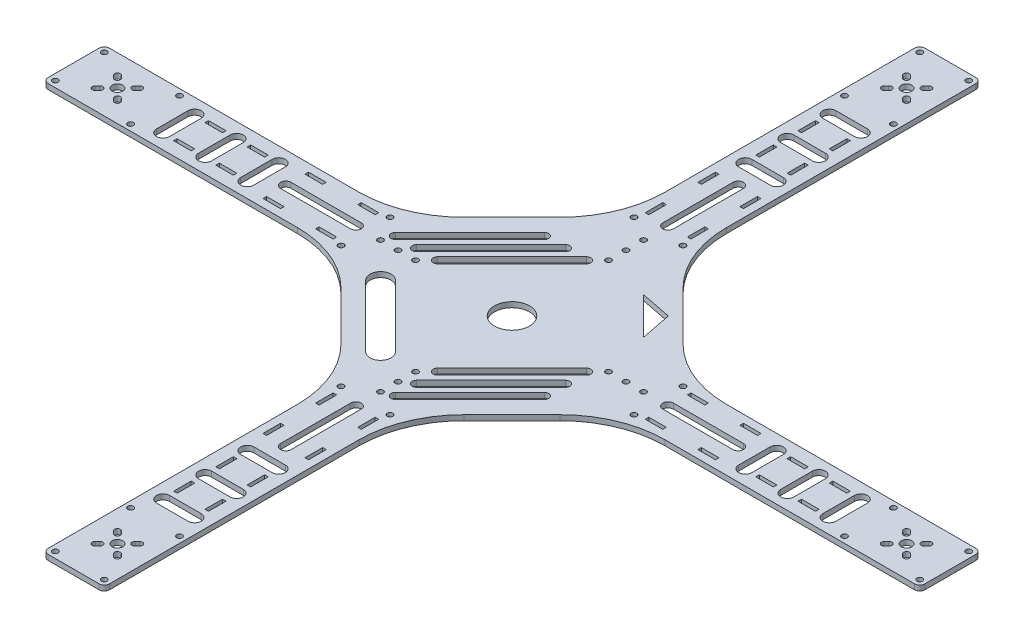
from build123d import *

# Parameters (mm, degrees)
SKETCH_221_R        = 1.6
SKETCH_221_R_2      = 3
SKETCH_221_W        = 2
SKETCH_221_H        = 10
SKETCH_221_W_2      = 10
SKETCH_221_H_2      = 2
EXTRUDE_1_DEPTH     = 3
SKETCH_1_R          = 1.6
SKETCH_1_R_2        = 10
CUT_EXTRUDE_1_DEPTH = 537.78114721
FILLET_1_R          = 3


with BuildPart() as part:
    # Sketch 221 → 凸台-拉伸1 (new body)
    with BuildSketch(Plane(origin=(0, 0, 0), x_dir=(1, 0, 0), z_dir=(0, 1, 0))):
        with BuildLine():
            Line((17.5, 25), (-17.5, 25))
            Line((-17.5, 25), (-17.5, -25))
            Line((-17.5, -25), (-17.5, -120.147186258))
            ThreePointArc((-17.5, -120.147186258), (-22.067228049, -143.1081922), (-35.073593129, -162.573593129))
            Line((-35.073593129, -162.573593129), (-62.426406871, -189.926406871))
            ThreePointArc((-62.426406871, -189.926406871), (-81.8918078, -202.932771951), (-104.852813742, -207.5))
            Line((-104.852813742, -207.5), (-200, -207.5))
            Line((-200, -207.5), (-250, -207.5))
            Line((-250, -207.5), (-250, -242.5))
            Line((-250, -242.5), (-200, -242.5))
            Line((-200, -242.5), (-104.852813742, -242.5))
            ThreePointArc((-104.852813742, -242.5), (-81.8918078, -247.067228049), (-62.426406871, -260.073593129))
            Line((-62.426406871, -260.073593129), (-35.073593129, -287.426406871))
            ThreePointArc((-35.073593129, -287.426406871), (-22.067228049, -306.8918078), (-17.5, -329.852813742))
            Line((-17.5, -329.852813742), (-17.5, -425))
            Line((-17.5, -425), (-17.5, -475))
            Line((-17.5, -475), (17.5, -475))
            Line((17.5, -475), (17.5, -425))
            Line((17.5, -425), (17.5, -329.852813742))
            ThreePointArc((17.5, -329.852813742), (22.067228049, -306.8918078), (35.073593129, -287.426406871))
            Line((35.073593129, -287.426406871), (62.426406871, -260.073593129))
            ThreePointArc((62.426406871, -260.073593129), (81.8918078, -247.067228049), (104.852813742, -242.5))
            Line((104.852813742, -242.5), (200, -242.5))
            Line((200, -242.5), (250, -242.5))
            Line((250, -242.5), (250, -207.5))
            Line((250, -207.5), (200, -207.5))
            Line((200, -207.5), (104.852813742, -207.5))
            ThreePointArc((104.852813742, -207.5), (81.8918078, -202.932771951), (62.426406871, -189.926406871))
            Line((62.426406871, -189.926406871), (35.073593129, -162.573593129))
            ThreePointArc((35.073593129, -162.573593129), (22.067228049, -143.1081922), (17.5, -120.147186258))
            Line((17.5, -120.147186258), (17.5, -25))
            Line((17.5, -25), (17.5, 25))
        make_face()
        with Locations(Location((-13.964466094, -471.464466094, 0), (0, 0, 270))):
            Circle(SKETCH_221_R, mode=Mode.SUBTRACT)
        with BuildLine():
            ThreePointArc((-6.081118318, -453.818376618), (-3.818376618, -453.818376618), (-3.818376618, -456.081118318))
            Line((-3.818376618, -456.081118318), (-5.232590181, -457.495331881))
            ThreePointArc((-5.232590181, -457.495331881), (-7.495331881, -457.495331881), (-7.495331881, -455.232590181))
            Line((-7.495331881, -455.232590181), (-6.081118318, -453.818376618))
        make_face(mode=Mode.SUBTRACT)
        with Locations(Location((0, -450, 0), (0, 0, 270))):
            Circle(SKETCH_221_R_2, mode=Mode.SUBTRACT)
        with BuildLine():
            ThreePointArc((-3.818376618, -443.918881682), (-3.818376618, -446.181623382), (-6.081118318, -446.181623382))
            Line((-6.081118318, -446.181623382), (-7.495331881, -444.767409819))
            ThreePointArc((-7.495331881, -444.767409819), (-7.495331881, -442.504668119), (-5.232590181, -442.504668119))
            Line((-5.232590181, -442.504668119), (-3.818376618, -443.918881682))
        make_face(mode=Mode.SUBTRACT)
        with Locations(Location((-13.964466094, -428.535533906, 0), (0, 0, 270))):
            Circle(SKETCH_221_R, mode=Mode.SUBTRACT)
        with BuildLine():
            ThreePointArc((-9, -418.75), (-12.75, -415), (-9, -411.25))
            Line((-9, -411.25), (9, -411.25))
            ThreePointArc((9, -411.25), (12.75, -415), (9, -418.75))
            Line((9, -418.75), (0, -418.75))
            Line((0, -418.75), (-9, -418.75))
        make_face(mode=Mode.SUBTRACT)
        Polygon((-7.93903755, -408), (-9, -408), (-9.93903755, -408), (-9.93903755, -398), (-9, -398), (-7.93903755, -398), align=None, mode=Mode.SUBTRACT)
        with Locations((-8.93903755, -378.95882731)):
            Rectangle(SKETCH_221_W, SKETCH_221_H, mode=Mode.SUBTRACT)
        with BuildLine():
            ThreePointArc((-244.864466094, -238.964466094), (-245.852172602, -240.442673346), (-247.595836944, -240.095836944))
            ThreePointArc((-247.595836944, -240.095836944), (-247.076759586, -237.486258842), (-244.864466094, -238.964466094))
        make_face(mode=Mode.SUBTRACT)
        with BuildLine():
            ThreePointArc((-231.081118318, -228.818376618), (-228.818376618, -228.818376618), (-228.818376618, -231.081118318))
            Line((-228.818376618, -231.081118318), (-230.232590181, -232.495331881))
            ThreePointArc((-230.232590181, -232.495331881), (-232.495331881, -232.495331881), (-232.495331881, -230.232590181))
            Line((-232.495331881, -230.232590181), (-231.081118318, -228.818376618))
        make_face(mode=Mode.SUBTRACT)
        with BuildLine():
            ThreePointArc((-221.181623382, -231.081118318), (-221.181623382, -228.818376618), (-218.918881682, -228.818376618))
            Line((-218.918881682, -228.818376618), (-217.504668119, -230.232590181))
            ThreePointArc((-217.504668119, -230.232590181), (-217.504668119, -232.495331881), (-219.767409819, -232.495331881))
            Line((-219.767409819, -232.495331881), (-221.181623382, -231.081118318))
        make_face(mode=Mode.SUBTRACT)
        with Locations(Location((-203.535533906, -238.964466094, 0), (0, 0, 270))):
            Circle(SKETCH_221_R, mode=Mode.SUBTRACT)
        with Locations((-178, -233.93903755)):
            Rectangle(SKETCH_221_W_2, SKETCH_221_H_2, mode=Mode.SUBTRACT)
        with Locations((-153.95882731, -233.93903755)):
            Rectangle(SKETCH_221_W_2, SKETCH_221_H_2, mode=Mode.SUBTRACT)
        with Locations((-12, -349)):
            Rectangle(SKETCH_221_W, SKETCH_221_H, mode=Mode.SUBTRACT)
        with Locations((-12, -319)):
            Rectangle(SKETCH_221_W, SKETCH_221_H, mode=Mode.SUBTRACT)
        with Locations(Location((-13.964466094, -308.535533906, 0), (0, 0, 270))):
            Circle(SKETCH_221_R, mode=Mode.SUBTRACT)
        with Locations((-124, -237)):
            Rectangle(SKETCH_221_W_2, SKETCH_221_H_2, mode=Mode.SUBTRACT)
        with Locations((-94, -237)):
            Rectangle(SKETCH_221_W_2, SKETCH_221_H_2, mode=Mode.SUBTRACT)
        with BuildLine():
            ThreePointArc((-89, -222), (-86, -225), (-89, -228))
            Line((-89, -228), (-129, -228))
            ThreePointArc((-129, -228), (-132, -225), (-129, -222))
            Line((-129, -222), (-89, -222))
        make_face(mode=Mode.SUBTRACT)
        with Locations(Location((-83.535533906, -238.964466094, 0), (0, 0, 270))):
            Circle(SKETCH_221_R, mode=Mode.SUBTRACT)
        with BuildLine():
            ThreePointArc((15.564466094, -471.464466094), (15.442673346, -472.076759586), (15.095836944, -472.595836944))
            ThreePointArc((15.095836944, -472.595836944), (12.486258842, -470.852172602), (15.564466094, -471.464466094))
        make_face(mode=Mode.SUBTRACT)
        with BuildLine():
            ThreePointArc((3.818376618, -456.081118318), (3.818376618, -453.818376618), (6.081118318, -453.818376618))
            Line((6.081118318, -453.818376618), (7.495331881, -455.232590181))
            ThreePointArc((7.495331881, -455.232590181), (7.495331881, -457.495331881), (5.232590181, -457.495331881))
            Line((5.232590181, -457.495331881), (3.818376618, -456.081118318))
        make_face(mode=Mode.SUBTRACT)
        with BuildLine():
            ThreePointArc((6.081118318, -446.181623382), (3.818376618, -446.181623382), (3.818376618, -443.918881682))
            Line((3.818376618, -443.918881682), (5.232590181, -442.504668119))
            ThreePointArc((5.232590181, -442.504668119), (7.495331881, -442.504668119), (7.495331881, -444.767409819))
            Line((7.495331881, -444.767409819), (6.081118318, -446.181623382))
        make_face(mode=Mode.SUBTRACT)
        with Locations(Location((13.964466094, -428.535533906, 0), (0, 0, 270))):
            Circle(SKETCH_221_R, mode=Mode.SUBTRACT)
        with Locations((8.93903755, -403)):
            Rectangle(SKETCH_221_W, SKETCH_221_H, mode=Mode.SUBTRACT)
        with BuildLine():
            Line((9, -394.75), (-9, -394.75))
            ThreePointArc((-9, -394.75), (-12.75, -391), (-9, -387.25))
            Line((-9, -387.25), (9, -387.25))
            ThreePointArc((9, -387.25), (12.75, -391), (9, -394.75))
        make_face(mode=Mode.SUBTRACT)
        with Locations((8.93903755, -378.95882731)):
            Rectangle(SKETCH_221_W, SKETCH_221_H, mode=Mode.SUBTRACT)
        with BuildLine():
            ThreePointArc((9, -363.25), (12.75, -367), (9, -370.75))
            Line((9, -370.75), (-9, -370.75))
            ThreePointArc((-9, -370.75), (-12.75, -367), (-9, -363.25))
            Line((-9, -363.25), (9, -363.25))
        make_face(mode=Mode.SUBTRACT)
        with Locations((12, -349)):
            Rectangle(SKETCH_221_W, SKETCH_221_H, mode=Mode.SUBTRACT)
        with BuildLine():
            ThreePointArc((-3, -314), (0, -311), (3, -314))
            Line((3, -314), (3, -354))
            ThreePointArc((3, -354), (0, -357), (-3, -354))
            Line((-3, -354), (-3, -314))
        make_face(mode=Mode.SUBTRACT)
        with Locations((12, -319)):
            Rectangle(SKETCH_221_W, SKETCH_221_H, mode=Mode.SUBTRACT)
        with Locations(Location((13.964466094, -308.535533906, 0), (0, 0, 270))):
            Circle(SKETCH_221_R, mode=Mode.SUBTRACT)
        with Locations(Location((83.535533906, -238.964466094, 0), (0, 0, 270))):
            Circle(SKETCH_221_R, mode=Mode.SUBTRACT)
        with Locations((94, -237)):
            Rectangle(SKETCH_221_W_2, SKETCH_221_H_2, mode=Mode.SUBTRACT)
        with Locations((124, -237)):
            Rectangle(SKETCH_221_W_2, SKETCH_221_H_2, mode=Mode.SUBTRACT)
        with Locations((153.95882731, -233.93903755)):
            Rectangle(SKETCH_221_W_2, SKETCH_221_H_2, mode=Mode.SUBTRACT)
        Polygon((183, -232.93903755), (183, -234), (183, -234.93903755), (173, -234.93903755), (173, -234), (173, -232.93903755), align=None, mode=Mode.SUBTRACT)
        with Locations(Location((203.535533906, -238.964466094, 0), (0, 0, 270))):
            Circle(SKETCH_221_R, mode=Mode.SUBTRACT)
        with BuildLine():
            ThreePointArc((218.918881682, -228.818376618), (221.181623382, -228.818376618), (221.181623382, -231.081118318))
            Line((221.181623382, -231.081118318), (219.767409819, -232.495331881))
            ThreePointArc((219.767409819, -232.495331881), (217.504668119, -232.495331881), (217.504668119, -230.232590181))
            Line((217.504668119, -230.232590181), (218.918881682, -228.818376618))
        make_face(mode=Mode.SUBTRACT)
        with BuildLine():
            ThreePointArc((228.818376618, -231.081118318), (228.818376618, -228.818376618), (231.081118318, -228.818376618))
            Line((231.081118318, -228.818376618), (232.495331881, -230.232590181))
            ThreePointArc((232.495331881, -230.232590181), (232.495331881, -232.495331881), (230.232590181, -232.495331881))
            Line((230.232590181, -232.495331881), (228.818376618, -231.081118318))
        make_face(mode=Mode.SUBTRACT)
        with Locations(Location((246.464466094, -238.964466094, 0), (0, 0, 270))):
            Circle(SKETCH_221_R, mode=Mode.SUBTRACT)
        with Locations(Location((-246.464466094, -211.035533906, 0), (0, 0, 270))):
            Circle(SKETCH_221_R, mode=Mode.SUBTRACT)
        with BuildLine():
            ThreePointArc((-228.818376618, -218.918881682), (-228.818376618, -221.181623382), (-231.081118318, -221.181623382))
            Line((-231.081118318, -221.181623382), (-232.495331881, -219.767409819))
            ThreePointArc((-232.495331881, -219.767409819), (-232.495331881, -217.504668119), (-230.232590181, -217.504668119))
            Line((-230.232590181, -217.504668119), (-228.818376618, -218.918881682))
        make_face(mode=Mode.SUBTRACT)
        with Locations(Location((-225, -225, 0), (0, 0, 270))):
            Circle(SKETCH_221_R_2, mode=Mode.SUBTRACT)
        with BuildLine():
            ThreePointArc((-218.918881682, -221.181623382), (-221.181623382, -221.181623382), (-221.181623382, -218.918881682))
            Line((-221.181623382, -218.918881682), (-219.767409819, -217.504668119))
            ThreePointArc((-219.767409819, -217.504668119), (-217.504668119, -217.504668119), (-217.504668119, -219.767409819))
            Line((-217.504668119, -219.767409819), (-218.918881682, -221.181623382))
        make_face(mode=Mode.SUBTRACT)
        with Locations(Location((-203.535533906, -211.035533906, 0), (0, 0, 270))):
            Circle(SKETCH_221_R, mode=Mode.SUBTRACT)
        with BuildLine():
            ThreePointArc((-193.75, -216), (-190, -212.25), (-186.25, -216))
            Line((-186.25, -216), (-186.25, -234))
            ThreePointArc((-186.25, -234), (-190, -237.75), (-193.75, -234))
            Line((-193.75, -234), (-193.75, -225))
            Line((-193.75, -225), (-193.75, -216))
        make_face(mode=Mode.SUBTRACT)
        Polygon((-183, -217.06096245), (-183, -216), (-183, -215.06096245), (-173, -215.06096245), (-173, -216), (-173, -217.06096245), align=None, mode=Mode.SUBTRACT)
        with BuildLine():
            Line((-169.75, -234), (-169.75, -216))
            ThreePointArc((-169.75, -216), (-166, -212.25), (-162.25, -216))
            Line((-162.25, -216), (-162.25, -234))
            ThreePointArc((-162.25, -234), (-166, -237.75), (-169.75, -234))
        make_face(mode=Mode.SUBTRACT)
        with BuildLine():
            ThreePointArc((-138.25, -234), (-142, -237.75), (-145.75, -234))
            Line((-145.75, -234), (-145.75, -216))
            ThreePointArc((-145.75, -216), (-142, -212.25), (-138.25, -216))
            Line((-138.25, -216), (-138.25, -234))
        make_face(mode=Mode.SUBTRACT)
        with Locations((-153.95882731, -216.06096245)):
            Rectangle(SKETCH_221_W_2, SKETCH_221_H_2, mode=Mode.SUBTRACT)
        with Locations((-124, -213)):
            Rectangle(SKETCH_221_W_2, SKETCH_221_H_2, mode=Mode.SUBTRACT)
        with Locations((-94, -213)):
            Rectangle(SKETCH_221_W_2, SKETCH_221_H_2, mode=Mode.SUBTRACT)
        with Locations(Location((-83.535533906, -211.035533906, 0), (0, 0, 270))):
            Circle(SKETCH_221_R, mode=Mode.SUBTRACT)
        with Locations(Location((-13.964466094, -141.464466094, 0), (0, 0, 270))):
            Circle(SKETCH_221_R, mode=Mode.SUBTRACT)
        with Locations((-12, -131)):
            Rectangle(SKETCH_221_W, SKETCH_221_H, mode=Mode.SUBTRACT)
        with BuildLine():
            ThreePointArc((3, -136), (0, -139), (-3, -136))
            Line((-3, -136), (-3, -96))
            ThreePointArc((-3, -96), (0, -93), (3, -96))
            Line((3, -96), (3, -136))
        make_face(mode=Mode.SUBTRACT)
        with Locations((-12, -101)):
            Rectangle(SKETCH_221_W, SKETCH_221_H, mode=Mode.SUBTRACT)
        with BuildLine():
            ThreePointArc((-9, -86.75), (-12.75, -83), (-9, -79.25))
            Line((-9, -79.25), (9, -79.25))
            ThreePointArc((9, -79.25), (12.75, -83), (9, -86.75))
            Line((9, -86.75), (-9, -86.75))
        make_face(mode=Mode.SUBTRACT)
        with Locations((-8.93903755, -71.04117269)):
            Rectangle(SKETCH_221_W, SKETCH_221_H, mode=Mode.SUBTRACT)
        with BuildLine():
            Line((-9, -55.25), (9, -55.25))
            ThreePointArc((9, -55.25), (12.75, -59), (9, -62.75))
            Line((9, -62.75), (-9, -62.75))
            ThreePointArc((-9, -62.75), (-12.75, -59), (-9, -55.25))
        make_face(mode=Mode.SUBTRACT)
        with Locations((-8.93903755, -47)):
            Rectangle(SKETCH_221_W, SKETCH_221_H, mode=Mode.SUBTRACT)
        with BuildLine():
            ThreePointArc((-9, -38.75), (-12.75, -35), (-9, -31.25))
            Line((-9, -31.25), (0, -31.25))
            Line((0, -31.25), (9, -31.25))
            ThreePointArc((9, -31.25), (12.75, -35), (9, -38.75))
            Line((9, -38.75), (-9, -38.75))
        make_face(mode=Mode.SUBTRACT)
        with Locations(Location((-13.964466094, -21.464466094, 0), (0, 0, 270))):
            Circle(SKETCH_221_R, mode=Mode.SUBTRACT)
        with BuildLine():
            ThreePointArc((-6.081118318, -3.818376618), (-3.818376618, -3.818376618), (-3.818376618, -6.081118318))
            Line((-3.818376618, -6.081118318), (-5.232590181, -7.495331881))
            ThreePointArc((-5.232590181, -7.495331881), (-7.495331881, -7.495331881), (-7.495331881, -5.232590181))
            Line((-7.495331881, -5.232590181), (-6.081118318, -3.818376618))
        make_face(mode=Mode.SUBTRACT)
        with Locations(Location((0, 0, 0), (0, 0, 270))):
            Circle(SKETCH_221_R_2, mode=Mode.SUBTRACT)
        with BuildLine():
            ThreePointArc((-3.818376618, 6.081118318), (-3.818376618, 3.818376618), (-6.081118318, 3.818376618))
            Line((-6.081118318, 3.818376618), (-7.495331881, 5.232590181))
            ThreePointArc((-7.495331881, 5.232590181), (-7.495331881, 7.495331881), (-5.232590181, 7.495331881))
            Line((-5.232590181, 7.495331881), (-3.818376618, 6.081118318))
        make_face(mode=Mode.SUBTRACT)
        with BuildLine():
            ThreePointArc((-12.364466094, 21.464466094), (-14.576759586, 19.986258842), (-15.095836944, 22.595836944))
            ThreePointArc((-15.095836944, 22.595836944), (-13.352172602, 22.942673346), (-12.364466094, 21.464466094))
        make_face(mode=Mode.SUBTRACT)
        with Locations(Location((83.535533906, -211.035533906, 0), (0, 0, 270))):
            Circle(SKETCH_221_R, mode=Mode.SUBTRACT)
        with BuildLine():
            ThreePointArc((89, -228), (86, -225), (89, -222))
            Line((89, -222), (129, -222))
            ThreePointArc((129, -222), (132, -225), (129, -228))
            Line((129, -228), (89, -228))
        make_face(mode=Mode.SUBTRACT)
        with Locations((94, -213)):
            Rectangle(SKETCH_221_W_2, SKETCH_221_H_2, mode=Mode.SUBTRACT)
        with Locations((124, -213)):
            Rectangle(SKETCH_221_W_2, SKETCH_221_H_2, mode=Mode.SUBTRACT)
        with Locations(Location((13.964466094, -141.464466094, 0), (0, 0, 270))):
            Circle(SKETCH_221_R, mode=Mode.SUBTRACT)
        with Locations((12, -131)):
            Rectangle(SKETCH_221_W, SKETCH_221_H, mode=Mode.SUBTRACT)
        with Locations((12, -101)):
            Rectangle(SKETCH_221_W, SKETCH_221_H, mode=Mode.SUBTRACT)
        with BuildLine():
            ThreePointArc((138.25, -216), (142, -212.25), (145.75, -216))
            Line((145.75, -216), (145.75, -234))
            ThreePointArc((145.75, -234), (142, -237.75), (138.25, -234))
            Line((138.25, -234), (138.25, -216))
        make_face(mode=Mode.SUBTRACT)
        with Locations((153.95882731, -216.06096245)):
            Rectangle(SKETCH_221_W_2, SKETCH_221_H_2, mode=Mode.SUBTRACT)
        with BuildLine():
            Line((169.75, -216), (169.75, -234))
            ThreePointArc((169.75, -234), (166, -237.75), (162.25, -234))
            Line((162.25, -234), (162.25, -216))
            ThreePointArc((162.25, -216), (166, -212.25), (169.75, -216))
        make_face(mode=Mode.SUBTRACT)
        with Locations((178, -216.06096245)):
            Rectangle(SKETCH_221_W_2, SKETCH_221_H_2, mode=Mode.SUBTRACT)
        with BuildLine():
            ThreePointArc((193.75, -234), (190, -237.75), (186.25, -234))
            Line((186.25, -234), (186.25, -216))
            ThreePointArc((186.25, -216), (190, -212.25), (193.75, -216))
            Line((193.75, -216), (193.75, -225))
            Line((193.75, -225), (193.75, -234))
        make_face(mode=Mode.SUBTRACT)
        with Locations(Location((203.535533906, -211.035533906, 0), (0, 0, 270))):
            Circle(SKETCH_221_R, mode=Mode.SUBTRACT)
        with Locations(Location((225, -225, 0), (0, 0, 270))):
            Circle(SKETCH_221_R_2, mode=Mode.SUBTRACT)
        with BuildLine():
            ThreePointArc((221.181623382, -218.918881682), (221.181623382, -221.181623382), (218.918881682, -221.181623382))
            Line((218.918881682, -221.181623382), (217.504668119, -219.767409819))
            ThreePointArc((217.504668119, -219.767409819), (217.504668119, -217.504668119), (219.767409819, -217.504668119))
            Line((219.767409819, -217.504668119), (221.181623382, -218.918881682))
        make_face(mode=Mode.SUBTRACT)
        with BuildLine():
            ThreePointArc((231.081118318, -221.181623382), (228.818376618, -221.181623382), (228.818376618, -218.918881682))
            Line((228.818376618, -218.918881682), (230.232590181, -217.504668119))
            ThreePointArc((230.232590181, -217.504668119), (232.495331881, -217.504668119), (232.495331881, -219.767409819))
            Line((232.495331881, -219.767409819), (231.081118318, -221.181623382))
        make_face(mode=Mode.SUBTRACT)
        with BuildLine():
            ThreePointArc((248.064466094, -211.035533906), (244.986258842, -211.647827398), (247.595836944, -209.904163056))
            ThreePointArc((247.595836944, -209.904163056), (247.942673346, -210.423240414), (248.064466094, -211.035533906))
        make_face(mode=Mode.SUBTRACT)
        with Locations((8.93903755, -71.04117269)):
            Rectangle(SKETCH_221_W, SKETCH_221_H, mode=Mode.SUBTRACT)
        Polygon((7.93903755, -42), (9, -42), (9.93903755, -42), (9.93903755, -52), (9, -52), (7.93903755, -52), align=None, mode=Mode.SUBTRACT)
        with Locations(Location((13.964466094, -21.464466094, 0), (0, 0, 270))):
            Circle(SKETCH_221_R, mode=Mode.SUBTRACT)
        with BuildLine():
            ThreePointArc((3.818376618, -6.081118318), (3.818376618, -3.818376618), (6.081118318, -3.818376618))
            Line((6.081118318, -3.818376618), (7.495331881, -5.232590181))
            ThreePointArc((7.495331881, -5.232590181), (7.495331881, -7.495331881), (5.232590181, -7.495331881))
            Line((5.232590181, -7.495331881), (3.818376618, -6.081118318))
        make_face(mode=Mode.SUBTRACT)
        with BuildLine():
            ThreePointArc((6.081118318, 3.818376618), (3.818376618, 3.818376618), (3.818376618, 6.081118318))
            Line((3.818376618, 6.081118318), (5.232590181, 7.495331881))
            ThreePointArc((5.232590181, 7.495331881), (7.495331881, 7.495331881), (7.495331881, 5.232590181))
            Line((7.495331881, 5.232590181), (6.081118318, 3.818376618))
        make_face(mode=Mode.SUBTRACT)
        with Locations(Location((13.964466094, 21.464466094, 0), (0, 0, 270))):
            Circle(SKETCH_221_R, mode=Mode.SUBTRACT)
    extrude(amount=EXTRUDE_1_DEPTH)

    # 草图1 → 切除-拉伸1 (cut, through all)
    with BuildSketch(Plane(origin=(0, 0, 0), x_dir=(1, 0, 0), z_dir=(0, 1, 0))):
        Polygon((26.870057685, -176.916738879), (48.083261121, -198.129942315), (44.547727215, -180.452272785), align=None)
        with Locations(Location((-65, -225, 0), (0, 0, 270))):
            Circle(SKETCH_1_R)
        with Locations(Location((-55, -225, 0), (0, 0, 270))):
            Circle(SKETCH_1_R)
        with Locations(Location((0, -160, 0), (0, 0, 270))):
            Circle(SKETCH_1_R)
        with BuildLine():
            ThreePointArc((-62.480970389, -216.945436483), (-62.480970389, -220.480970389), (-58.945436483, -220.480970389))
            Line((-58.945436483, -220.480970389), (-16.519029611, -178.054563517))
            ThreePointArc((-16.519029611, -178.054563517), (-16.519029611, -174.519029611), (-20.054563517, -174.519029611))
            Line((-20.054563517, -174.519029611), (-62.480970389, -216.945436483))
        make_face()
        with BuildLine():
            Line((-8.054563517, -174.519029611), (-50.480970389, -216.945436483))
            ThreePointArc((-50.480970389, -216.945436483), (-50.480970389, -220.480970389), (-46.945436483, -220.480970389))
            Line((-46.945436483, -220.480970389), (-4.519029611, -178.054563517))
            ThreePointArc((-4.519029611, -178.054563517), (-4.519029611, -174.519029611), (-8.054563517, -174.519029611))
        make_face()
        with BuildLine():
            Line((-32.054563517, -174.519029611), (-74.480970389, -216.945436483))
            ThreePointArc((-74.480970389, -216.945436483), (-74.480970389, -220.480970389), (-70.945436483, -220.480970389))
            Line((-70.945436483, -220.480970389), (-28.519029611, -178.054563517))
            ThreePointArc((-28.519029611, -178.054563517), (-28.519029611, -174.519029611), (-32.054563517, -174.519029611))
        make_face()
        with BuildLine():
            ThreePointArc((4.519029611, -271.945436483), (4.519029611, -275.480970389), (8.054563517, -275.480970389))
            Line((8.054563517, -275.480970389), (50.480970389, -233.054563517))
            ThreePointArc((50.480970389, -233.054563517), (50.480970389, -229.519029611), (46.945436483, -229.519029611))
            Line((46.945436483, -229.519029611), (4.519029611, -271.945436483))
        make_face()
        with BuildLine():
            ThreePointArc((4.519029611, -283.945436483), (4.519029611, -287.480970389), (8.054563517, -287.480970389))
            Line((8.054563517, -287.480970389), (50.480970389, -245.054563517))
            ThreePointArc((50.480970389, -245.054563517), (50.480970389, -241.519029611), (46.945436483, -241.519029611))
            Line((46.945436483, -241.519029611), (4.519029611, -283.945436483))
        make_face()
        with BuildLine():
            ThreePointArc((4.519029611, -295.945436483), (4.519029611, -299.480970389), (8.054563517, -299.480970389))
            Line((8.054563517, -299.480970389), (50.480970389, -257.054563517))
            ThreePointArc((50.480970389, -257.054563517), (50.480970389, -253.519029611), (46.945436483, -253.519029611))
            Line((46.945436483, -253.519029611), (4.519029611, -295.945436483))
        make_face()
        with BuildLine():
            Line((-33.234018716, -258.234018716), (-50.911688245, -240.556349186))
            ThreePointArc((-50.911688245, -240.556349186), (-59.39696962, -240.556349186), (-59.39696962, -249.04163056))
            Line((-59.39696962, -249.04163056), (-24.04163056, -284.39696962))
            ThreePointArc((-24.04163056, -284.39696962), (-15.556349186, -284.39696962), (-15.556349186, -275.911688245))
            Line((-15.556349186, -275.911688245), (-33.234018716, -258.234018716))
        make_face()
        with Locations(Location((0, -150, 0), (0, 0, 270))):
            Circle(SKETCH_1_R)
        with Locations(Location((0, -170, 0), (0, 0, 270))):
            Circle(SKETCH_1_R)
        with Locations(Location((75, -225, 0), (0, 0, 270))):
            Circle(SKETCH_1_R)
        with Locations(Location((65, -225, 0), (0, 0, 270))):
            Circle(SKETCH_1_R)
        with Locations(Location((55, -225, 0), (0, 0, 270))):
            Circle(SKETCH_1_R)
        with Locations(Location((0, -300, 0), (0, 0, 270))):
            Circle(SKETCH_1_R)
        with Locations(Location((0, -290, 0), (0, 0, 270))):
            Circle(SKETCH_1_R)
        with Locations(Location((0, -280, 0), (0, 0, 270))):
            Circle(SKETCH_1_R)
        with Locations(Location((-75, -225, 0), (0, 0, 270))):
            Circle(SKETCH_1_R)
        with Locations(Location((0, -225, 0), (0, 0, 270))):
            Circle(SKETCH_1_R_2)
    extrude(amount=CUT_EXTRUDE_1_DEPTH, mode=Mode.SUBTRACT)

    # 圆角1
    fillet_1_edges = [part.edges().sort_by_distance(p)[0] for p in [
        (-17.5, 1.5, -25),
        (17.5, 1.5, -25),
        (250, 1.5, 207.5),
        (250, 1.5, 242.5),
        (17.5, 1.5, 475),
        (-17.5, 1.5, 475),
        (-250, 1.5, 242.5),
        (-250, 1.5, 207.5),
    ]]
    fillet(fillet_1_edges, radius=FILLET_1_R)


solid = part.part
